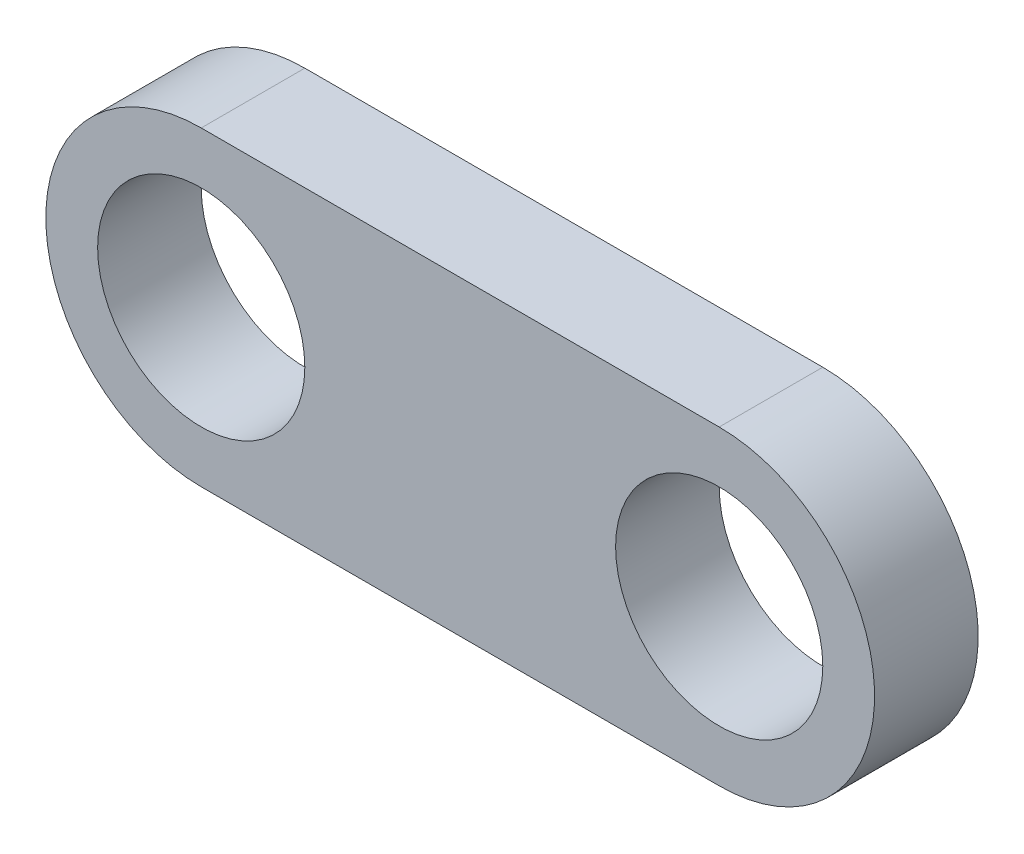
from build123d import *

# Parameters (mm, degrees)
SKETCH1_R           = 10
BOSS_EXTRUDE1_DEPTH = 10


with BuildPart() as part:
    # Sketch1 → Boss-Extrude1 (new body)
    with BuildSketch(Plane.XY):
        with BuildLine():
            Line((0, 15), (50, 15))
            ThreePointArc((50, 15), (65, 0), (50, -15))
            Line((50, -15), (0, -15))
            ThreePointArc((0, -15), (-15, 0), (0, 15))
        make_face()
        Circle(SKETCH1_R, mode=Mode.SUBTRACT)
        with Locations((50, 0)):
            Circle(SKETCH1_R, mode=Mode.SUBTRACT)
    extrude(amount=BOSS_EXTRUDE1_DEPTH)


solid = part.part
